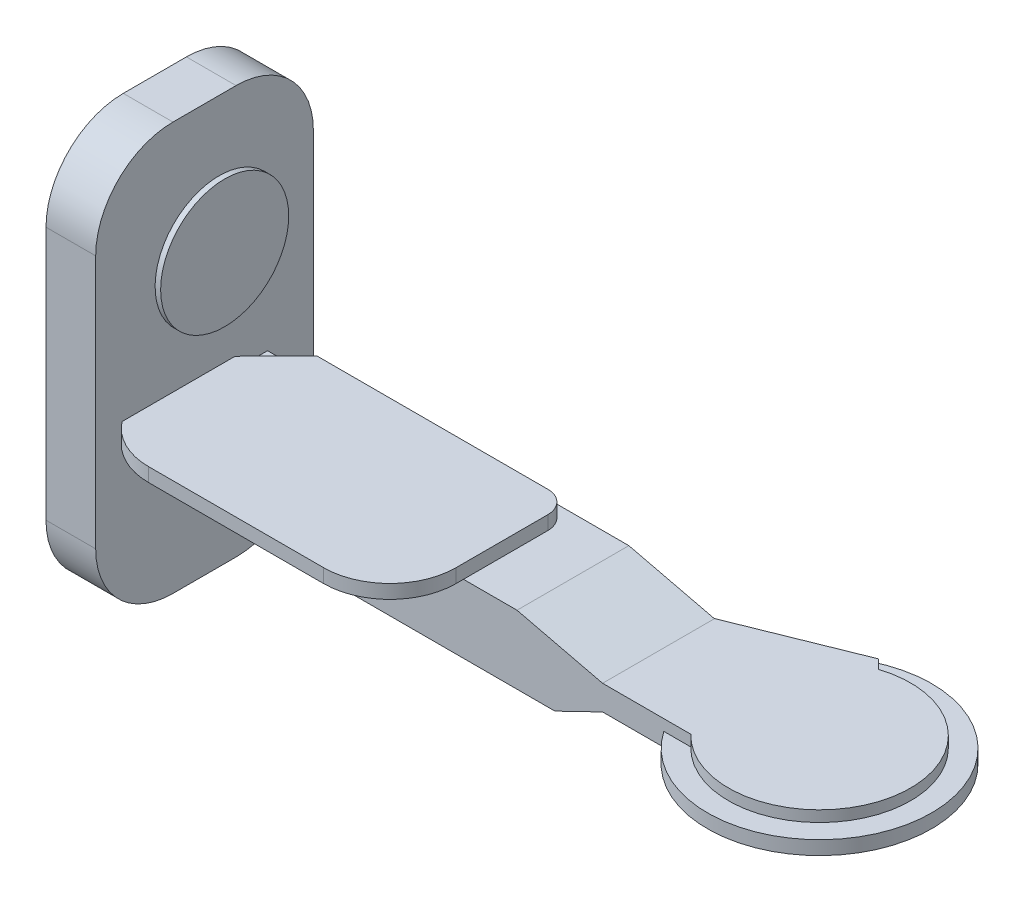
from build123d import *

# Parameters (mm, degrees)
SKETCH2_R                 = 203
BOSS_EXTRUDE1_DEPTH       = 25
SKETCH3_R                 = 165
BOSS_EXTRUDE4_DEPTH       = 20
BOSS_EXTRUDE6_DEPTH       = 45
BOSS_EXTRUDE7_DEPTH       = 202.626802206
SKETCH12_W                = 400
SKETCH12_H                = 84
CUT_EXTRUDE2_DEPTH        = 195
SKETCH13_R                = 65
BOSS_EXTRUDE8_DEPTH       = 5
SKETCH14_R                = 59.5
BOSS_EXTRUDE9_DEPTH       = 14
SKETCH15_R                = 21.046280496
BOSS_EXTRUDE10_DEPTH      = 14
BOSS_EXTRUDE11_DEPTH      = 25
BOSS_EXTRUDE12_DEPTH      = 65
BOSS_EXTRUDE12_DEPTH_BACK = 25
BOSS_EXTRUDE13_DEPTH      = 25
BOSS_EXTRUDE13_DEPTH_BACK = 15
FILLET1_R                 = 10
SKETCH20_R                = 116.015
BOSS_EXTRUDE14_DEPTH      = 10


with BuildPart() as part:
    # Sketch2 → Boss-Extrude1 (new body)
    with BuildSketch(Plane(origin=(0, 0, 0), x_dir=(1, 0, 0), z_dir=(0, 1, 0))):
        with Locations(Location((0, 0, 0), (0, 0, 270))):
            Circle(SKETCH2_R)
    extrude(amount=BOSS_EXTRUDE1_DEPTH)

    # Sketch3 → Boss-Extrude4 (add)
    with BuildSketch(Plane(origin=(0, 25, 0), x_dir=(1, 0, 0), z_dir=(0, 1, 0))):
        with Locations(Location((0, 0, 0), (0, 0, 270))):
            Circle(SKETCH3_R)
    extrude(amount=BOSS_EXTRUDE4_DEPTH)

    # Sketch8 → Boss-Extrude6 (add)
    with BuildSketch(Plane(origin=(0, 45, 0), x_dir=(1, 0, 0), z_dir=(0, 1, 0))):
        Polygon((-36.218523686, 88.373197794), (-36.218523686, 142.845857418), (-66.931831772, 173.559165504), (-278.448010099, 88.373197794), (-278.448010099, -114.626802206), (-36.218523686, -114.626802206), align=None)
    extrude(amount=-BOSS_EXTRUDE6_DEPTH)

    # Sketch11 → Boss-Extrude7 (add)
    with BuildSketch(Plane.XY.offset(-88)):
        Polygon((-278.448010099, 0), (-364.82630567, -41.890214301), (-773.82630567, -41.890214301), (-773.82630567, 82.109785699), (-433.530139449, 82.109785699), (-278.448010099, 45), align=None)
    extrude(amount=BOSS_EXTRUDE7_DEPTH)

    # Sketch12 → Cut-Extrude2 (cut)
    with BuildSketch(Plane(origin=(0, 0, -88), x_dir=(-1, 0, 0), z_dir=(0, 0, -1))):
        with Locations((573.82630567, 20.109785699)):
            Rectangle(SKETCH12_W, SKETCH12_H)
    extrude(amount=-CUT_EXTRUDE2_DEPTH, mode=Mode.SUBTRACT)

    # Sketch13 → Boss-Extrude8 (add)
    with BuildSketch(Plane.XZ.offset(41.890214301)):
        with Locations((-572.873962689, 13.972710812)):
            Circle(SKETCH13_R)
    extrude(amount=BOSS_EXTRUDE8_DEPTH)

    # Sketch14 → Boss-Extrude9 (add)
    with BuildSketch(Plane.XZ.offset(46.890214301)):
        with Locations((-572.873962689, 13.972710812)):
            Circle(SKETCH14_R)
    extrude(amount=BOSS_EXTRUDE9_DEPTH)

    # Sketch15 → Boss-Extrude10 (add)
    with BuildSketch(Plane(origin=(0, 82.109785699, 0), x_dir=(1, 0, 0), z_dir=(0, 1, 0))):
        with Locations(Location((-702.441522293, -14.627430099, 0), (0, 0, 90))):
            Circle(SKETCH15_R)
        with Locations(Location((-628.892568706, -14.627430099, 0), (0, 0, 90))):
            Circle(SKETCH15_R)
        with Locations(Location((-572.1226233, -14.627430099, 0), (0, 0, 90))):
            Circle(SKETCH15_R)
    extrude(amount=BOSS_EXTRUDE10_DEPTH)

    # Sketch16 → Boss-Extrude11 (add)
    with BuildSketch(Plane(origin=(0, 96.109785699, 0), x_dir=(1, 0, 0), z_dir=(0, 1, 0))):
        with BuildLine():
            Line((-556.497428598, 64.069909455), (-974.176536307, 64.069909455))
            Line((-974.176536307, 64.069909455), (-1038.149417409, 0.097028353))
            ThreePointArc((-1038.149417409, 0.097028353), (-1064.162147568, -38.833773506), (-1073.296603667, -84.75578539))
            Line((-1073.296603667, -84.75578539), (-1073.296603667, -142.077234659))
            ThreePointArc((-1073.296603667, -142.077234659), (-1038.149417409, -226.930048402), (-953.296603667, -262.077234659))
            Line((-953.296603667, -262.077234659), (-636.497428598, -262.077234659))
            ThreePointArc((-636.497428598, -262.077234659), (-551.644614856, -226.930048402), (-516.497428598, -142.077234659))
            Line((-516.497428598, -142.077234659), (-516.497428598, 24.069909455))
            ThreePointArc((-516.497428598, 24.069909455), (-528.213157351, 52.354180702), (-556.497428598, 64.069909455))
        make_face()
    extrude(amount=BOSS_EXTRUDE11_DEPTH)

    # Sketch17 → Boss-Extrude12 (add, two sides: drawn at the far end of the back side and taken through both)
    with BuildSketch(Plane.ZY.offset(1073.296603667).offset(-BOSS_EXTRUDE12_DEPTH_BACK)):
        with BuildLine():
            Line((8.768612392, 544.923564191), (123.173449264, 544.923564191))
            ThreePointArc((123.173449264, 544.923564191), (222.16839863, 503.918513558), (263.173449264, 404.923564191))
            Line((263.173449264, 404.923564191), (263.173449264, -54.759891123))
            ThreePointArc((263.173449264, -54.759891123), (222.16839863, -153.754840489), (123.173449264, -194.759891123))
            Line((123.173449264, -194.759891123), (8.768612392, -194.759891123))
            ThreePointArc((8.768612392, -194.759891123), (-90.226336974, -153.754840489), (-131.231387608, -54.759891123))
            Line((-131.231387608, -54.759891123), (-131.231387608, 404.923564191))
            ThreePointArc((-131.231387608, 404.923564191), (-90.226336974, 503.918513558), (8.768612392, 544.923564191))
        make_face()
    extrude(amount=BOSS_EXTRUDE12_DEPTH + BOSS_EXTRUDE12_DEPTH_BACK)

    # Sketch19 → Boss-Extrude13 (add, two sides: drawn at the far end of the back side and taken through both)
    with BuildSketch(Plane(origin=(0, 0, -23.231387608), x_dir=(-1, 0, 0), z_dir=(0, 0, -1)).offset(-BOSS_EXTRUDE13_DEPTH_BACK)):
        Polygon((1052.931156926, -16.752524753), (985.063520649, 100.43883668), (1052.931156926, 100.43883668), align=None)
    extrude(amount=BOSS_EXTRUDE13_DEPTH + BOSS_EXTRUDE13_DEPTH_BACK)

    # Fillet1
    fillet1_edges = [part.edges().sort_by_distance(p)[0] for p in [
        (-1048.296603667, -8.749747053, -28.231387608),
        (-987.570552343, 96.109785699, -28.231387608),
    ]]
    fillet(fillet1_edges, radius=FILLET1_R)

    # Sketch20 → Boss-Extrude14 (add)
    with BuildSketch(Plane(origin=(-1048.296603667, 0, 0), x_dir=(0, 0, -1), z_dir=(1, 0, 0))):
        with Locations(Location((-39.49671875, 302.878292984, 0), (0, 0, 270))):
            Circle(SKETCH20_R)
    extrude(amount=BOSS_EXTRUDE14_DEPTH)


solid = part.part
